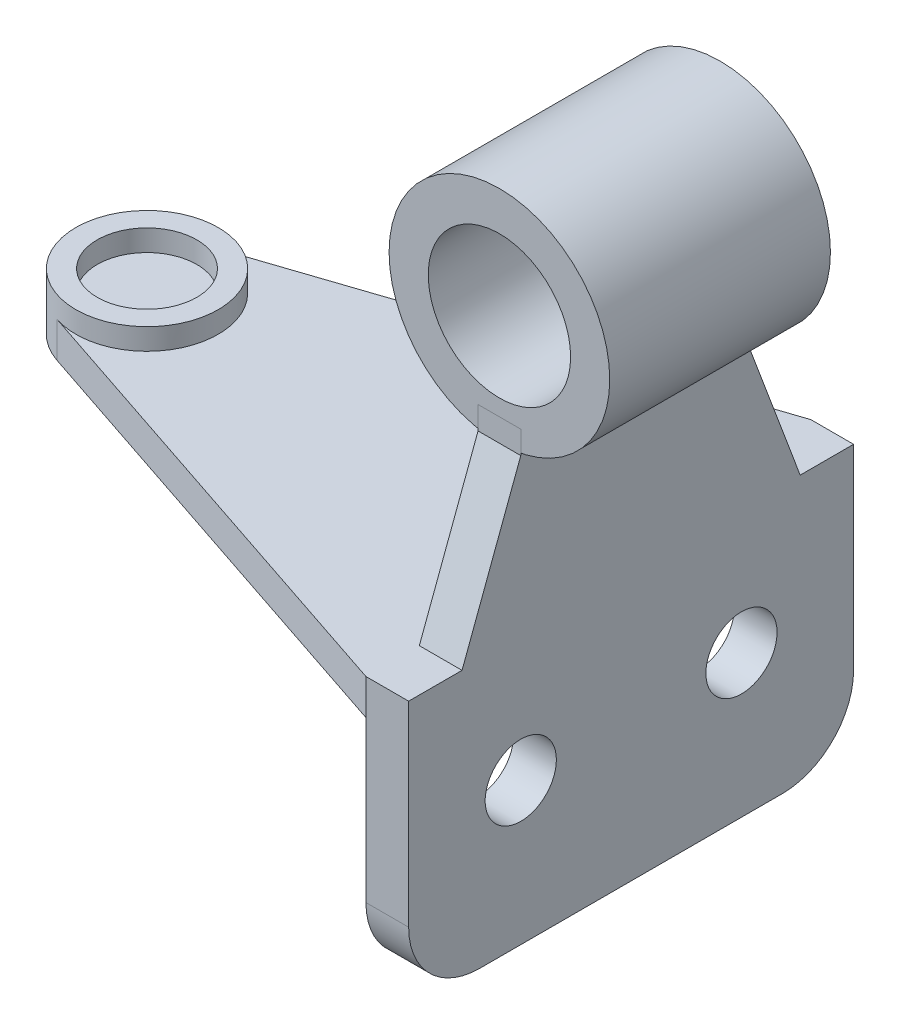
from build123d import *

# Parameters (mm, degrees)
BOSS_EXTRUDE1_DEPTH      = 10
SKETCH3_R                = 20
SKETCH3_R_2              = 14
BOSS_EXTRUDE3_DEPTH      = 6
BOSS_EXTRUDE4_DEPTH      = 31
BOSS_EXTRUDE4_DEPTH_BACK = 31
SKETCH7_R                = 31
SKETCH7_R_2              = 20
BOSS_EXTRUDE5_DEPTH      = 12
BOSS_EXTRUDE6_DEPTH      = 12
SKETCH10_R               = 10
BOSS_EXTRUDE7_DEPTH      = 12
SKETCH10_4_R             = 10
CUT_EXTRUDE2_DEPTH       = 12


with BuildPart() as part:
    # Sketch2 → Boss-Extrude1 (new body)
    with BuildSketch(Plane(origin=(0, 0, 0), x_dir=(1, 0, 0), z_dir=(0, 1, 0))):
        with BuildLine():
            Line((0, 0), (0, 62.5))
            Line((0, 62.5), (-12, 62.5))
            Line((-12, 62.5), (-142.335664896, 18.969959154))
            ThreePointArc((-142.335664896, 18.969959154), (-156, 0), (-142.335664896, -18.969959154))
            Line((-142.335664896, -18.969959154), (-12, -62.5))
            Line((-12, -62.5), (0, -62.5))
            Line((0, -62.5), (0, 0))
        make_face()
    extrude(amount=BOSS_EXTRUDE1_DEPTH)

    # Sketch3 → Boss-Extrude3 (add)
    with BuildSketch(Plane(origin=(0, 10, 0), x_dir=(1, 0, 0), z_dir=(0, 1, 0))):
        with Locations((-136, 0)):
            Circle(SKETCH3_R)
        with Locations((-136, 0)):
            Circle(SKETCH3_R_2, mode=Mode.SUBTRACT)
    extrude(amount=BOSS_EXTRUDE3_DEPTH)

    # Sketch8 → Boss-Extrude5 (add)
    with BuildSketch(Plane(origin=(0, 0, 0), x_dir=(0, 0, -1), z_dir=(1, 0, 0))):
        Polygon((-47.5, 10), (-31, 54), (-31, 60.431012935), (31, 60.431012935), (31, 54), (47.5, 10), align=None)
    extrude(amount=-BOSS_EXTRUDE5_DEPTH)

    # Sketch9 → Boss-Extrude6 (add)
    with BuildSketch(Plane(origin=(0, 0, 0), x_dir=(0, 0, -1), z_dir=(1, 0, 0))):
        with BuildLine():
            Line((-62.5, 0), (62.5, 0))
            Line((62.5, 0), (62.5, -45))
            ThreePointArc((62.5, -45), (56.642135624, -59.142135624), (42.5, -65))
            Line((42.5, -65), (-42.5, -65))
            ThreePointArc((-42.5, -65), (-56.642135624, -59.142135624), (-62.5, -45))
            Line((-62.5, -45), (-62.5, 0))
        make_face()
    extrude(amount=-BOSS_EXTRUDE6_DEPTH)

    # Sketch10 → Boss-Extrude7 (add)
    with BuildSketch(Plane(origin=(0, 0, 0), x_dir=(0, 0, -1), z_dir=(1, 0, 0))):
        with Locations((-31, -25)):
            Circle(SKETCH10_R)
        with Locations((31, -25)):
            Circle(SKETCH10_R)
    extrude(amount=-BOSS_EXTRUDE7_DEPTH)

    # Sketch10<4> → Cut-Extrude2 (cut)
    with BuildSketch(Plane(origin=(0, 0, 0), x_dir=(0, 0, -1), z_dir=(1, 0, 0))):
        with Locations((-31, -25)):
            Circle(SKETCH10_4_R)
        with Locations((31, -25)):
            Circle(SKETCH10_4_R)
    extrude(amount=-CUT_EXTRUDE2_DEPTH, mode=Mode.SUBTRACT)


with BuildPart() as body_2:
    # Sketch7 → Boss-Extrude4 (new, two sides: drawn at the far end of the back side and taken through both)
    with BuildSketch(Plane.XY.offset(-BOSS_EXTRUDE4_DEPTH_BACK)):
        with Locations((-6, 85)):
            Circle(SKETCH7_R)
        with Locations((-6, 85)):
            Circle(SKETCH7_R_2, mode=Mode.SUBTRACT)
    extrude(amount=BOSS_EXTRUDE4_DEPTH + BOSS_EXTRUDE4_DEPTH_BACK)


solid = Compound([part.part, body_2.part])
